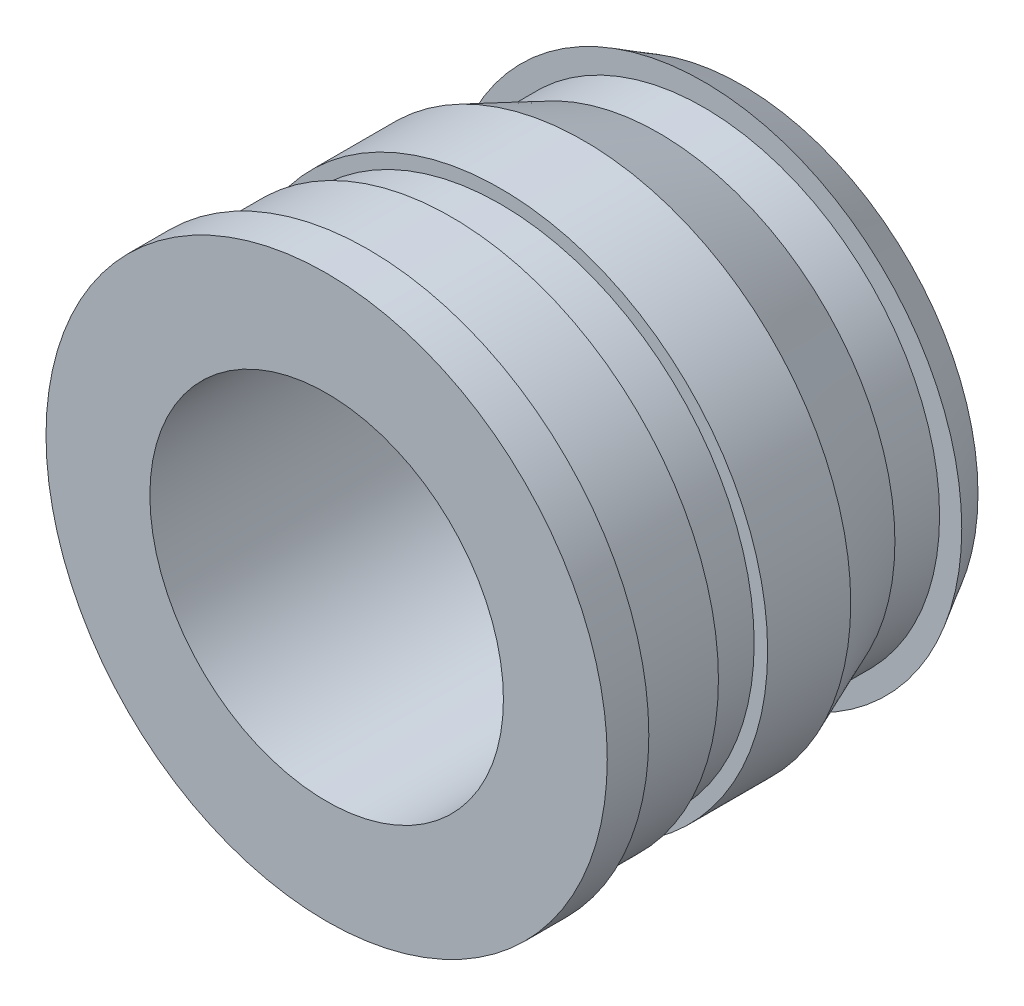
from build123d import *


with BuildPart() as part:
    # Sketch3 → Revolve1 (revolve)
    with BuildSketch(Plane(origin=(0, 0, 0), x_dir=(0, 0, -1), z_dir=(1, 0, 0)), mode=Mode.PRIVATE) as revolve1_sk:
        Polygon((-2.35, 2), (-2.35, 3.175), (-1.88, 3.175), (-1.88, 3.0225), (-0.94, 3.0225), (-0.94, 2.87), (-0.383183073, 2.87), (-0.383183073, 3.0225), (0.556816927, 3.0225), (1.41, 2.6691), (1.915428452, 2.6691), (1.915428452, 2.92), (2.35, 2.6691), (2.35, 2), align=None)
    revolve(revolve1_sk.sketch.rotate(Axis((0, 0, 2.35), (0, 0, -1)), 90), axis=Axis((0, 0, 2.35), (0, 0, -1)))


solid = part.part
